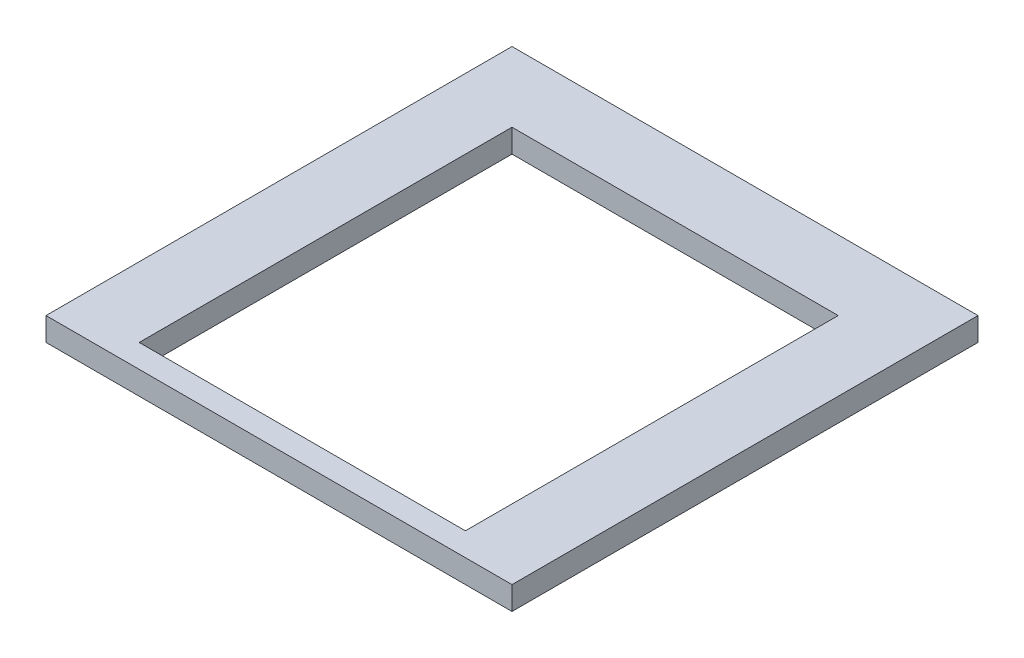
from build123d import *

# Parameters (mm, degrees)
SKETCH_1_W          = 20
SKETCH_1_H          = 20
EXTRUDE_1_DEPTH     = 6
CUT_EXTRUDE_START   = 1
SKETCH_3_W          = 18
SKETCH_3_H          = 19
CUT_EXTRUDE_1_DEPTH = 6
EXTRUDE_START       = 6
SKETCH_4_W          = 20
SKETCH_4_H          = 20
EXTRUDE_2_DEPTH     = 1
CUT_EXTRUDE_START_2 = 7
SKETCH_7_W          = 14
SKETCH_7_H          = 16
CUT_EXTRUDE_3_DEPTH = 1
SKETCH_9_W          = 20
SKETCH_9_H          = 20
CUT_EXTRUDE_5_DEPTH = 6


with BuildPart() as part:
    # 스케치1 → 보스-돌출1 (new body)
    with BuildSketch(Plane(origin=(0, 0, 0), x_dir=(1, 0, 0), z_dir=(0, 1, 0))):
        Rectangle(SKETCH_1_W, SKETCH_1_H)
    extrude(amount=EXTRUDE_1_DEPTH)

    # 스케치3 → 컷-돌출1 (cut)
    with BuildSketch(Plane(origin=(0, 0, 0), x_dir=(1, 0, 0), z_dir=(0, 1, 0)).offset(CUT_EXTRUDE_START)):
        with Locations((0, 0.5)):
            Rectangle(SKETCH_3_W, SKETCH_3_H)
    extrude(amount=CUT_EXTRUDE_1_DEPTH, mode=Mode.SUBTRACT)

    # 스케치9 → 컷-돌출5 (cut)
    with BuildSketch(Plane.XZ):
        Rectangle(SKETCH_9_W, SKETCH_9_H)
    extrude(amount=-CUT_EXTRUDE_5_DEPTH, mode=Mode.SUBTRACT)


with BuildPart() as body_2:
    # 스케치4 → 보스-돌출2 (new body)
    with BuildSketch(Plane(origin=(0, 0, 0), x_dir=(1, 0, 0), z_dir=(0, 1, 0)).offset(EXTRUDE_START)):
        Rectangle(SKETCH_4_W, SKETCH_4_H)
    extrude(amount=EXTRUDE_2_DEPTH)

    # 스케치7 → 컷-돌출3 (cut)
    with BuildSketch(Plane(origin=(0, 0, 0), x_dir=(1, 0, 0), z_dir=(0, 1, 0)).offset(CUT_EXTRUDE_START_2)):
        with Locations((0, -1)):
            Rectangle(SKETCH_7_W, SKETCH_7_H)
    extrude(amount=-CUT_EXTRUDE_3_DEPTH, mode=Mode.SUBTRACT)


solid = body_2.part
